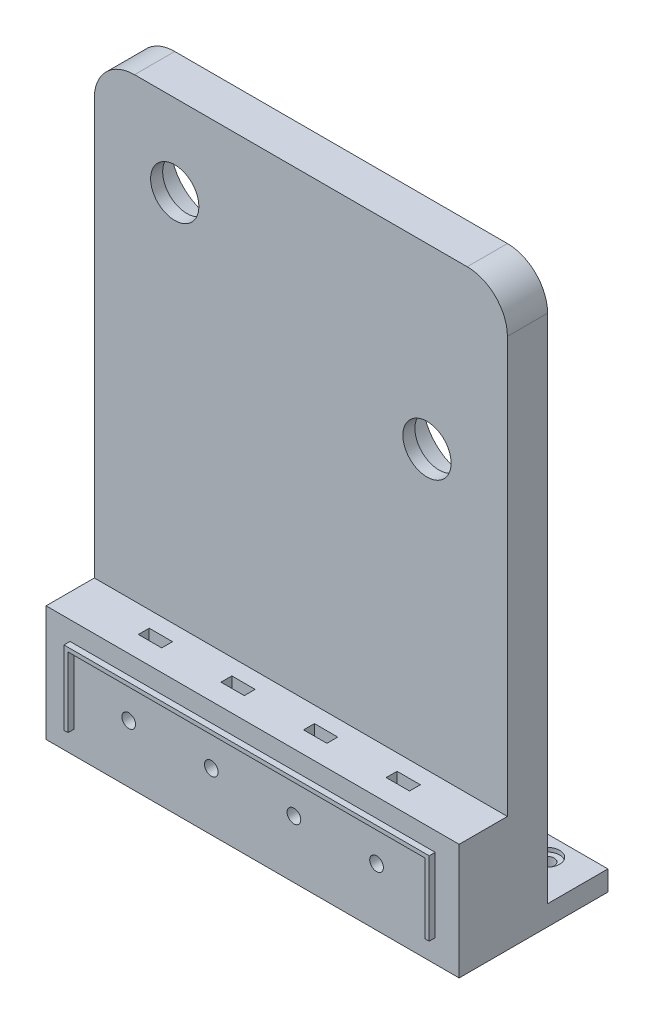
from build123d import *

# Parameters (mm, degrees)
SKETCH2_R           = 11.05
BOSS_EXTRUDE2_DEPTH = 10
BOSS_EXTRUDE3_START = 7
SKETCH2_4_R         = 11.05
SKETCH2_4_R_2       = 6
BOSS_EXTRUDE3_DEPTH = 3
SKETCH3_W           = 102.73844499
SKETCH3_H           = 28.8
BOSS_EXTRUDE4_DEPTH = 12
SKETCH4_W           = 5.8
SKETCH4_H           = 17.75
CUT_EXTRUDE2_DEPTH  = 8
SKETCH4_7_W         = 5.8
SKETCH4_7_H         = 17.75
SKETCH4_7_R         = 1.7
BOSS_EXTRUDE5_DEPTH = 5.3
BOSS_EXTRUDE6_DEPTH = 1.5
SKETCH6_W           = 102.73844499
SKETCH6_H           = 25
BOSS_EXTRUDE7_DEPTH = 5
SKETCH7_R           = 1.65
CUT_EXTRUDE3_DEPTH  = 5
SKETCH7_6_R         = 3
SKETCH7_6_R_2       = 1.65
CUT_EXTRUDE4_DEPTH  = 1


with BuildPart() as part:
    # Sketch2 → Boss-Extrude2 (new body)
    with BuildSketch(Plane.XY):
        with BuildLine():
            ThreePointArc((0, -10), (-2.928932188, -2.928932188), (-10, 0))
            Line((-10, 0), (-92.73844499, 0))
            ThreePointArc((-92.73844499, 0), (-99.809512802, -2.928932188), (-102.73844499, -10))
            Line((-102.73844499, -10), (-102.73844499, -142.20223365))
            Line((-102.73844499, -142.20223365), (0, -142.20223365))
            Line((0, -142.20223365), (0, -10))
        make_face()
        with Locations((-82.73844499, -20.4)):
            Circle(SKETCH2_R, mode=Mode.SUBTRACT)
        with Locations((-20, -44.29848365)):
            Circle(SKETCH2_R, mode=Mode.SUBTRACT)
    extrude(amount=BOSS_EXTRUDE2_DEPTH)

    # Sketch2<4> → Boss-Extrude3 (add)
    # profile 1 of 2: a face of its own
    with BuildSketch(Plane.XY.offset(BOSS_EXTRUDE3_START)):
        with Locations((-82.73844499, -20.4)):
            Circle(SKETCH2_4_R)
        with Locations((-82.73844499, -20.4)):
            Circle(SKETCH2_4_R_2, mode=Mode.SUBTRACT)
    # profile 2 of 2: a face of its own
    with BuildSketch(Plane.XY.offset(BOSS_EXTRUDE3_START)):
        with Locations((-20, -44.29848365)):
            Circle(SKETCH2_4_R)
        with Locations((-20, -44.29848365)):
            Circle(SKETCH2_4_R_2, mode=Mode.SUBTRACT)
    extrude(amount=BOSS_EXTRUDE3_DEPTH)

    # Sketch3 → Boss-Extrude4 (add)
    with BuildSketch(Plane.XY.offset(10)):
        with Locations((-51.369222495, -127.80223365)):
            Rectangle(SKETCH3_W, SKETCH3_H)
    extrude(amount=BOSS_EXTRUDE4_DEPTH)

    # Sketch4 → Cut-Extrude2 (cut)
    with BuildSketch(Plane.XY.offset(22)):
        with Locations((-61.64306899, -122.27723365)):
            Rectangle(SKETCH4_W, SKETCH4_H)
        with Locations((-82.19075699, -122.27723365)):
            Rectangle(SKETCH4_W, SKETCH4_H)
        with Locations((-41.09538099, -122.27723365)):
            Rectangle(SKETCH4_W, SKETCH4_H)
        with Locations((-20.54769299, -122.27723365)):
            Rectangle(SKETCH4_W, SKETCH4_H)
    extrude(amount=-CUT_EXTRUDE2_DEPTH, mode=Mode.SUBTRACT)

    # Sketch4<7> → Boss-Extrude5 (add)
    # profile 1 of 4: a face of its own
    with BuildSketch(Plane.XY.offset(22)):
        with Locations((-61.64306899, -122.27723365)):
            Rectangle(SKETCH4_7_W, SKETCH4_7_H)
        with Locations((-61.64306899, -127.85223365)):
            Circle(SKETCH4_7_R, mode=Mode.SUBTRACT)
    # profile 2 of 4: a face of its own
    with BuildSketch(Plane.XY.offset(22)):
        with Locations((-82.19075699, -122.27723365)):
            Rectangle(SKETCH4_7_W, SKETCH4_7_H)
        with Locations((-82.19075699, -127.85223365)):
            Circle(SKETCH4_7_R, mode=Mode.SUBTRACT)
    # profile 3 of 4: a face of its own
    with BuildSketch(Plane.XY.offset(22)):
        with Locations((-41.09538099, -122.27723365)):
            Rectangle(SKETCH4_7_W, SKETCH4_7_H)
        with Locations((-41.09538099, -127.85223365)):
            Circle(SKETCH4_7_R, mode=Mode.SUBTRACT)
    # profile 4 of 4: a face of its own
    with BuildSketch(Plane.XY.offset(22)):
        with Locations((-20.54769299, -122.27723365)):
            Rectangle(SKETCH4_7_W, SKETCH4_7_H)
        with Locations((-20.54769299, -127.85223365)):
            Circle(SKETCH4_7_R, mode=Mode.SUBTRACT)
    extrude(amount=-BOSS_EXTRUDE5_DEPTH)

    # Sketch5 → Boss-Extrude6 (add)
    with BuildSketch(Plane.XY.offset(22)):
        Polygon((-95.78844499, -136.50223365), (-96.78844499, -136.50223365), (-96.78844499, -118.10223365), (-5.95, -118.10223365), (-5.95, -136.50223365), (-6.95, -136.50223365), (-6.95, -119.10223365), (-95.78844499, -119.10223365), align=None)
    extrude(amount=BOSS_EXTRUDE6_DEPTH)

    # Sketch6 → Boss-Extrude7 (add)
    with BuildSketch(Plane.XZ.offset(142.20223365)):
        with Locations((-51.369222495, -2.5)):
            Rectangle(SKETCH6_W, SKETCH6_H)
    extrude(amount=-BOSS_EXTRUDE7_DEPTH)

    # Sketch7 → Cut-Extrude3 (cut)
    with BuildSketch(Plane(origin=(-101.64020113, -137.20223365, -23.052849439), x_dir=(-1, 0, 0), z_dir=(0, 1, 0))):
        with Locations((-91.64020113, 13.052849439)):
            Circle(SKETCH7_R)
        with Locations((-50.270978635, 18.052849439)):
            Circle(SKETCH7_R)
        with Locations((-8.90175614, 13.052849439)):
            Circle(SKETCH7_R)
    extrude(amount=-CUT_EXTRUDE3_DEPTH, mode=Mode.SUBTRACT)

    # Sketch7<6> → Cut-Extrude4 (cut)
    # profile 1 of 3: a face of its own
    with BuildSketch(Plane(origin=(-101.64020113, -137.20223365, -23.052849439), x_dir=(-1, 0, 0), z_dir=(0, 1, 0))):
        with Locations((-91.64020113, 13.052849439)):
            Circle(SKETCH7_6_R)
        with Locations((-91.64020113, 13.052849439)):
            Circle(SKETCH7_6_R_2, mode=Mode.SUBTRACT)
    # profile 2 of 3: a face of its own
    with BuildSketch(Plane(origin=(-101.64020113, -137.20223365, -23.052849439), x_dir=(-1, 0, 0), z_dir=(0, 1, 0))):
        with Locations((-50.270978635, 18.052849439)):
            Circle(SKETCH7_6_R)
        with Locations((-50.270978635, 18.052849439)):
            Circle(SKETCH7_6_R_2, mode=Mode.SUBTRACT)
    # profile 3 of 3: a face of its own
    with BuildSketch(Plane(origin=(-101.64020113, -137.20223365, -23.052849439), x_dir=(-1, 0, 0), z_dir=(0, 1, 0))):
        with Locations((-8.90175614, 13.052849439)):
            Circle(SKETCH7_6_R)
        with Locations((-8.90175614, 13.052849439)):
            Circle(SKETCH7_6_R_2, mode=Mode.SUBTRACT)
    extrude(amount=-CUT_EXTRUDE4_DEPTH, mode=Mode.SUBTRACT)


solid = part.part
